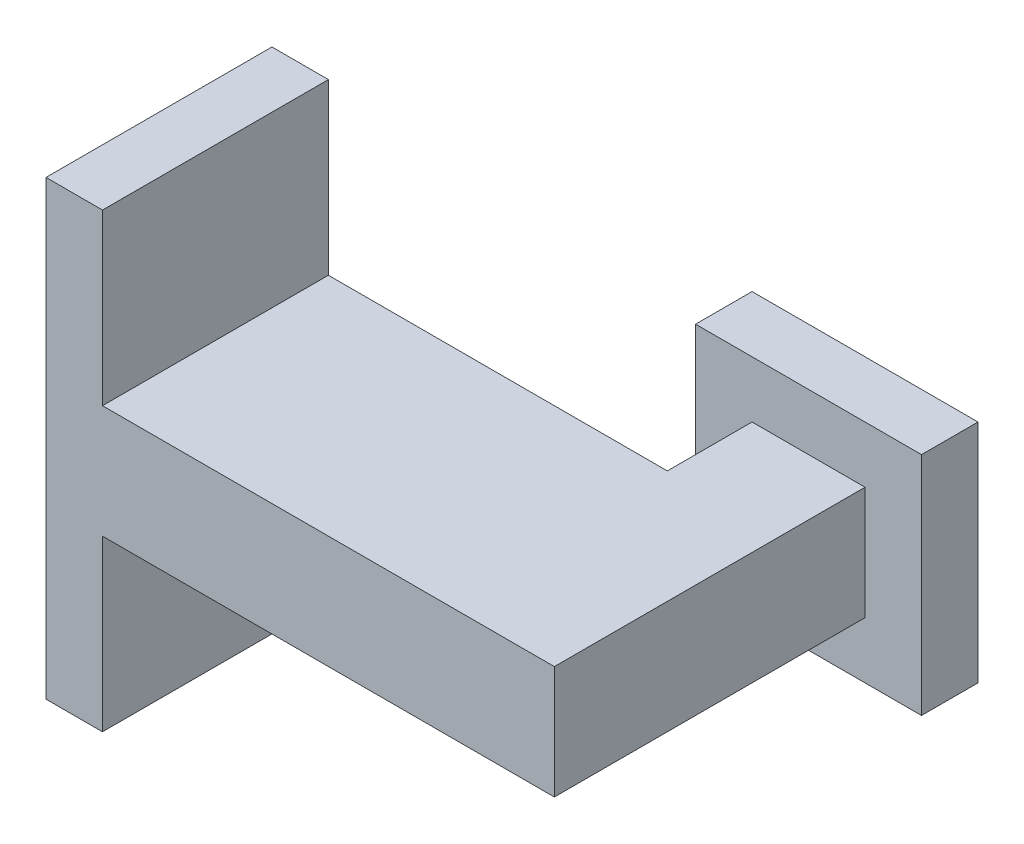
from build123d import *

# Parameters (mm, degrees)
ESQUISSE1_W             = 20
ESQUISSE1_H             = 20
BOSS_EXTRU_1_DEPTH      = 5
ESQUISSE3_W             = 10
ESQUISSE3_H             = 10
BOSS_EXTRU_2_DEPTH      = 27.5
ESQUISSE7_W             = 20
ESQUISSE7_H             = 10
BOSS_EXTRU_3_DEPTH      = 30
ESQUISSE8_W             = 20
ESQUISSE8_H             = 40
BOSS_EXTRU_4_DEPTH      = 5
ESQUISSE9_R             = 1.5
ENL_V_MAT_EXTRU_1_DEPTH = 22
FILETAGE1_PITCH         = 1.25
FILETAGE1_HEIGHT        = 15
FILETAGE1_RADIUS        = 1.5
FILETAGE1_START_ANGLE   = 0.999999975


with BuildPart() as part:
    # Esquisse1 → Boss.-Extru.1 (new body)
    with BuildSketch(Plane.XY):
        Rectangle(ESQUISSE1_W, ESQUISSE1_H)
    extrude(amount=BOSS_EXTRU_1_DEPTH)

    # Esquisse3 → Boss.-Extru.2 (add)
    with BuildSketch(Plane.XY.offset(5)):
        Rectangle(ESQUISSE3_W, ESQUISSE3_H)
    extrude(amount=BOSS_EXTRU_2_DEPTH)

    # Esquisse7 → Boss.-Extru.3 (add)
    with BuildSketch(Plane.ZY.offset(5)):
        with Locations((22.5, 0)):
            Rectangle(ESQUISSE7_W, ESQUISSE7_H)
    extrude(amount=BOSS_EXTRU_3_DEPTH)

    # Esquisse8 → Boss.-Extru.4 (add)
    with BuildSketch(Plane.ZY.offset(35)):
        with Locations((22.5, 0)):
            Rectangle(ESQUISSE8_W, ESQUISSE8_H)
    extrude(amount=BOSS_EXTRU_4_DEPTH)

    # Esquisse9 → Enlèv. mat.-Extru.1 (cut)
    with BuildSketch(Plane(origin=(0, 0, 0), x_dir=(-1, 0, 0), z_dir=(0, 0, -1))):
        Circle(ESQUISSE9_R)
    extrude(amount=-ENL_V_MAT_EXTRU_1_DEPTH, mode=Mode.SUBTRACT)

    # Filetage1: sweep along a helix
    with BuildLine() as filetage1_path:
        add(Helix(FILETAGE1_PITCH, FILETAGE1_HEIGHT, FILETAGE1_RADIUS, center=(0, 0, 1), direction=(0, 0, 1), mode=Mode.PRIVATE).rotate(Axis((0, 0, 1), (0, 0, 1)), FILETAGE1_START_ANGLE))
    # Profil de filetage2 → Filetage1 (sweep, cut)
    with BuildSketch(Plane(origin=(1.499771543, 0.02617861, 1), x_dir=(0.9998476951563913, 0.017452406437283515, 0), z_dir=(0.017452406437283515, -0.9998476951563913, 0))):
        Polygon((0, 0), (0.171851915, 0.09921875), (0.171851915, 0.13890625), (0, 0.238124999), align=None)
    sweep(path=filetage1_path.line, is_frenet=True, mode=Mode.SUBTRACT)


solid = part.part
